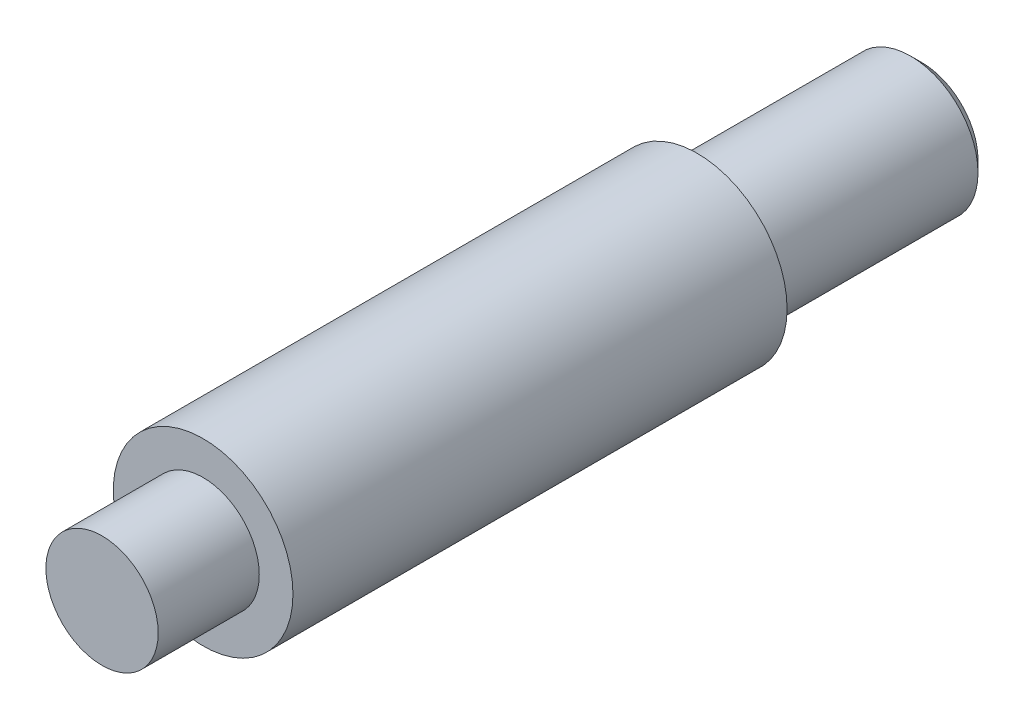
from build123d import *

# Parameters (mm, degrees)
ESQUISSE1_R          = 8
BASE_EXTRUSION_DEPTH = 44
ESQUISSE2_R          = 5
BOSS_EXTRU_1_DEPTH   = 9
ESQUISSE3_R          = 6
BOSS_EXTRU_2_DEPTH   = 20
CHANFREIN1_SIZE      = 1


with BuildPart() as part:
    # Esquisse1 → Base-Extrusion (new body)
    with BuildSketch(Plane.XY):
        Circle(ESQUISSE1_R)
    extrude(amount=BASE_EXTRUSION_DEPTH)

    # Esquisse2 → Boss.-Extru.1 (add)
    with BuildSketch(Plane.XY.offset(44)):
        Circle(ESQUISSE2_R)
    extrude(amount=BOSS_EXTRU_1_DEPTH)

    # Esquisse3 → Boss.-Extru.2 (add)
    with BuildSketch(Plane(origin=(0, 0, 0), x_dir=(-1, 0, 0), z_dir=(0, 0, -1))):
        with Locations(Location((0, 0, 0), (0, 0, 180))):
            Circle(ESQUISSE3_R)
    extrude(amount=BOSS_EXTRU_2_DEPTH)

    # Chanfrein1
    chanfrein1_edges = [part.edges().sort_by_distance(p)[0] for p in [
        (-6, 0, -20),
    ]]
    chamfer(chanfrein1_edges, length=CHANFREIN1_SIZE)


solid = part.part
